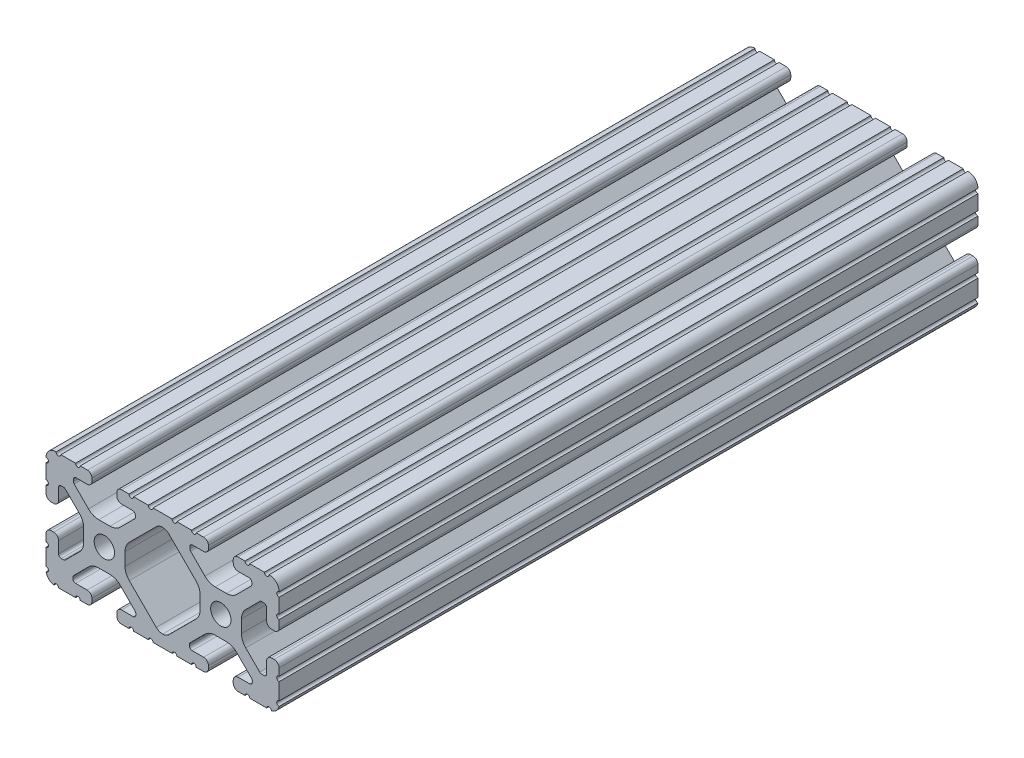
from build123d import *

# Parameters (mm, degrees)
SKETCH1_R      = 3.3274
EXTRUDE1_DEPTH = 228.6


with BuildPart() as part:
    # Sketch1 → Extrude1 (new body)
    with BuildSketch(Plane.XY):
        with BuildLine():
            Line((-3.121121376, -19.05), (3.121121376, -19.05))
            ThreePointArc((3.121121376, -19.05), (3.883121376, -18.288), (4.645121376, -19.05))
            Line((4.645121376, -19.05), (8.633115796, -19.05))
            Line((8.633115796, -19.05), (9.473536067, -19.05))
            ThreePointArc((9.473536067, -19.05), (10.235536067, -18.288), (10.997536067, -19.05))
            Line((10.997536067, -19.05), (13.4112, -19.05))
            ThreePointArc((13.4112, -19.05), (14.524751759, -18.588751759), (14.986, -17.4752))
            Line((14.986, -17.4752), (14.986, -16.5608))
            ThreePointArc((14.986, -16.5608), (14.524751759, -15.447248241), (13.4112, -14.986))
            Line((13.4112, -14.986), (9.652, -14.986))
            ThreePointArc((9.652, -14.986), (9.023382072, -14.725617928), (8.763, -14.097))
            Line((8.763, -14.097), (8.763, -13.687179678))
            ThreePointArc((8.763, -13.687179678), (8.830670671, -13.346975131), (9.023380503, -13.058563318))
            Line((9.023380503, -13.058563318), (13.852498595, -8.229421131))
            ThreePointArc((13.852498595, -8.229421131), (15.393447522, -7.199787805), (17.211122763, -6.838228541))
            Line((17.211122763, -6.838228541), (20.888877237, -6.838228541))
            ThreePointArc((20.888877237, -6.838228541), (22.706552478, -7.199787805), (24.247501405, -8.229421131))
            Line((24.247501405, -8.229421131), (29.076619497, -13.058563318))
            ThreePointArc((29.076619497, -13.058563318), (29.269329329, -13.346975131), (29.337, -13.687179678))
            Line((29.337, -13.687179678), (29.337, -14.097))
            ThreePointArc((29.337, -14.097), (29.076617928, -14.725617928), (28.448, -14.986))
            Line((28.448, -14.986), (24.6888, -14.986))
            ThreePointArc((24.6888, -14.986), (23.575248241, -15.447248241), (23.114, -16.5608))
            Line((23.114, -16.5608), (23.114, -17.4752))
            ThreePointArc((23.114, -17.4752), (23.575248241, -18.588751759), (24.6888, -19.05))
            Line((24.6888, -19.05), (26.945817469, -19.05))
            ThreePointArc((26.945817469, -19.05), (27.707817469, -18.288), (28.469817469, -19.05))
            Line((28.469817469, -19.05), (29.207115796, -19.05))
            Line((29.207115796, -19.05), (34.047273398, -19.05))
            ThreePointArc((34.047273398, -19.05), (34.809273398, -18.288), (35.571273398, -19.05))
            ThreePointArc((35.571273398, -19.05), (37.207577603, -18.182738167), (38.1, -16.560019212))
            ThreePointArc((38.1, -16.560019212), (37.338, -15.798019212), (38.1, -15.036019212))
            Line((38.1, -15.036019212), (38.1, -10.287))
            Line((38.1, -10.287), (38.1, -9.549701672))
            ThreePointArc((38.1, -9.549701672), (37.338, -8.787701672), (38.1, -8.025701672))
            Line((38.1, -8.025701672), (38.1, -5.6388))
            ThreePointArc((38.1, -5.6388), (37.638751759, -4.525248241), (36.5252, -4.064))
            Line((36.5252, -4.064), (35.6108, -4.064))
            ThreePointArc((35.6108, -4.064), (34.497248241, -4.525248241), (34.036, -5.6388))
            Line((34.036, -5.6388), (34.036, -9.398))
            ThreePointArc((34.036, -9.398), (33.775617928, -10.026617928), (33.147, -10.287))
            Line((33.147, -10.287), (32.420656743, -10.287))
            ThreePointArc((32.420656743, -10.287), (32.080450147, -10.21932848), (31.792037247, -10.02661636))
            Line((31.792037247, -10.02661636), (27.197575832, -5.43213202))
            ThreePointArc((27.197575832, -5.43213202), (26.167954729, -3.891188903), (25.8064, -2.07352461))
            Line((25.8064, -2.07352461), (25.8064, 2.07352461))
            ThreePointArc((25.8064, 2.07352461), (26.167954729, 3.891188903), (27.197575832, 5.43213202))
            Line((27.197575832, 5.43213202), (31.792037247, 10.02661636))
            ThreePointArc((31.792037247, 10.02661636), (32.080450147, 10.21932848), (32.420656743, 10.287))
            Line((32.420656743, 10.287), (33.147, 10.287))
            ThreePointArc((33.147, 10.287), (33.775617928, 10.026617928), (34.036, 9.398))
            Line((34.036, 9.398), (34.036, 5.6388))
            ThreePointArc((34.036, 5.6388), (34.497248241, 4.525248241), (35.6108, 4.064))
            Line((35.6108, 4.064), (36.5252, 4.064))
            ThreePointArc((36.5252, 4.064), (37.638751759, 4.525248241), (38.1, 5.6388))
            Line((38.1, 5.6388), (38.1, 8.025701672))
            ThreePointArc((38.1, 8.025701672), (37.338, 8.787701672), (38.1, 9.549701672))
            Line((38.1, 9.549701672), (38.1, 10.287))
            Line((38.1, 10.287), (38.1, 14.375206214))
            ThreePointArc((38.1, 14.375206214), (37.338232276, 15.156019383), (38.137614868, 15.89827725))
            ThreePointArc((38.137614868, 15.89827725), (37.148019028, 18.192014021), (34.819536496, 19.096833012))
            ThreePointArc((34.819536496, 19.096833012), (34.081312886, 18.311776389), (33.296256263, 19.05))
            Line((33.296256263, 19.05), (29.207115796, 19.05))
            Line((29.207115796, 19.05), (28.469817468, 19.05))
            ThreePointArc((28.469817468, 19.05), (27.707817468, 18.288), (26.945817468, 19.05))
            Line((26.945817468, 19.05), (24.558915796, 19.05))
            ThreePointArc((24.558915796, 19.05), (23.53023695, 18.547208069), (23.114, 17.480565346))
            Line((23.114, 17.480565346), (23.114, 16.5608))
            ThreePointArc((23.114, 16.5608), (23.575248241, 15.447248241), (24.6888, 14.986))
            Line((24.6888, 14.986), (28.295243665, 14.986))
            ThreePointArc((28.295243665, 14.986), (28.923861593, 14.725617928), (29.184243665, 14.097))
            Line((29.184243665, 14.097), (29.184243665, 13.53442258))
            ThreePointArc((29.184243665, 13.53442258), (29.116572993, 13.194218033), (28.923863161, 12.90580622))
            Line((28.923863161, 12.90580622), (24.247501405, 8.229421131))
            ThreePointArc((24.247501405, 8.229421131), (22.706552478, 7.199787805), (20.888877237, 6.838228541))
            Line((20.888877237, 6.838228541), (17.211122763, 6.838228541))
            ThreePointArc((17.211122763, 6.838228541), (15.393447522, 7.199787805), (13.852498595, 8.229421131))
            Line((13.852498595, 8.229421131), (9.176136839, 12.90580622))
            ThreePointArc((9.176136839, 12.90580622), (8.983427007, 13.194218033), (8.915756335, 13.53442258))
            Line((8.915756335, 13.53442258), (8.915756335, 14.097))
            ThreePointArc((8.915756335, 14.097), (9.176138407, 14.725617928), (9.804756335, 14.986))
            Line((9.804756335, 14.986), (13.4112, 14.986))
            ThreePointArc((13.4112, 14.986), (14.524751759, 15.447248241), (14.986, 16.5608))
            Line((14.986, 16.5608), (14.986, 17.496772581))
            ThreePointArc((14.986, 17.496772581), (14.531070222, 18.595070222), (13.432772581, 19.05))
            Line((13.432772581, 19.05), (10.997536067, 19.05))
            ThreePointArc((10.997536067, 19.05), (10.235536067, 18.288), (9.473536067, 19.05))
            Line((9.473536067, 19.05), (8.633115796, 19.05))
            Line((8.633115796, 19.05), (4.645121376, 19.05))
            ThreePointArc((4.645121376, 19.05), (3.883121376, 18.288), (3.121121376, 19.05))
            Line((3.121121376, 19.05), (-3.121121376, 19.05))
            ThreePointArc((-3.121121376, 19.05), (-3.883121376, 18.288), (-4.645121376, 19.05))
            Line((-4.645121376, 19.05), (-8.633115796, 19.05))
            Line((-8.633115796, 19.05), (-9.473536067, 19.05))
            ThreePointArc((-9.473536067, 19.05), (-10.235536067, 18.288), (-10.997536067, 19.05))
            Line((-10.997536067, 19.05), (-13.432772581, 19.05))
            ThreePointArc((-13.432772581, 19.05), (-14.531070222, 18.595070222), (-14.986, 17.496772581))
            Line((-14.986, 17.496772581), (-14.986, 16.5608))
            ThreePointArc((-14.986, 16.5608), (-14.524751759, 15.447248241), (-13.4112, 14.986))
            Line((-13.4112, 14.986), (-9.804756335, 14.986))
            ThreePointArc((-9.804756335, 14.986), (-9.176138407, 14.725617928), (-8.915756335, 14.097))
            Line((-8.915756335, 14.097), (-8.915756335, 13.53442258))
            ThreePointArc((-8.915756335, 13.53442258), (-8.983427007, 13.194218033), (-9.176136839, 12.90580622))
            Line((-9.176136839, 12.90580622), (-13.852498595, 8.229421131))
            ThreePointArc((-13.852498595, 8.229421131), (-15.393447522, 7.199787805), (-17.211122763, 6.838228541))
            Line((-17.211122763, 6.838228541), (-20.888877237, 6.838228541))
            ThreePointArc((-20.888877237, 6.838228541), (-22.706552478, 7.199787805), (-24.247501405, 8.229421131))
            Line((-24.247501405, 8.229421131), (-28.923863161, 12.90580622))
            ThreePointArc((-28.923863161, 12.90580622), (-29.116572993, 13.194218033), (-29.184243665, 13.53442258))
            Line((-29.184243665, 13.53442258), (-29.184243665, 14.097))
            ThreePointArc((-29.184243665, 14.097), (-28.923861593, 14.725617928), (-28.295243665, 14.986))
            Line((-28.295243665, 14.986), (-24.6888, 14.986))
            ThreePointArc((-24.6888, 14.986), (-23.575248241, 15.447248241), (-23.114, 16.5608))
            Line((-23.114, 16.5608), (-23.114, 17.480565346))
            ThreePointArc((-23.114, 17.480565346), (-23.53023695, 18.547208069), (-24.558915796, 19.05))
            Line((-24.558915796, 19.05), (-26.945817468, 19.05))
            ThreePointArc((-26.945817468, 19.05), (-27.707817468, 18.288), (-28.469817468, 19.05))
            Line((-28.469817468, 19.05), (-29.207115796, 19.05))
            Line((-29.207115796, 19.05), (-33.296256263, 19.05))
            ThreePointArc((-33.296256263, 19.05), (-34.081312886, 18.311776389), (-34.819536496, 19.096833012))
            ThreePointArc((-34.819536496, 19.096833012), (-37.148019028, 18.192014021), (-38.137614868, 15.89827725))
            ThreePointArc((-38.137614868, 15.89827725), (-37.338232276, 15.156019383), (-38.1, 14.375206214))
            Line((-38.1, 14.375206214), (-38.1, 10.287))
            Line((-38.1, 10.287), (-38.1, 9.549701672))
            ThreePointArc((-38.1, 9.549701672), (-37.338, 8.787701672), (-38.1, 8.025701672))
            Line((-38.1, 8.025701672), (-38.1, 5.6388))
            ThreePointArc((-38.1, 5.6388), (-37.638751759, 4.525248241), (-36.5252, 4.064))
            Line((-36.5252, 4.064), (-35.6108, 4.064))
            ThreePointArc((-35.6108, 4.064), (-34.497248241, 4.525248241), (-34.036, 5.6388))
            Line((-34.036, 5.6388), (-34.036, 9.398))
            ThreePointArc((-34.036, 9.398), (-33.775617928, 10.026617928), (-33.147, 10.287))
            Line((-33.147, 10.287), (-32.420656743, 10.287))
            ThreePointArc((-32.420656743, 10.287), (-32.080450147, 10.21932848), (-31.792037247, 10.02661636))
            Line((-31.792037247, 10.02661636), (-27.197575832, 5.43213202))
            ThreePointArc((-27.197575832, 5.43213202), (-26.167954729, 3.891188903), (-25.8064, 2.07352461))
            Line((-25.8064, 2.07352461), (-25.8064, -2.07352461))
            ThreePointArc((-25.8064, -2.07352461), (-26.167954729, -3.891188903), (-27.197575832, -5.43213202))
            Line((-27.197575832, -5.43213202), (-31.792037247, -10.02661636))
            ThreePointArc((-31.792037247, -10.02661636), (-32.080450147, -10.21932848), (-32.420656743, -10.287))
            Line((-32.420656743, -10.287), (-33.147, -10.287))
            ThreePointArc((-33.147, -10.287), (-33.775617928, -10.026617928), (-34.036, -9.398))
            Line((-34.036, -9.398), (-34.036, -5.6388))
            ThreePointArc((-34.036, -5.6388), (-34.497248241, -4.525248241), (-35.6108, -4.064))
            Line((-35.6108, -4.064), (-36.5252, -4.064))
            ThreePointArc((-36.5252, -4.064), (-37.638751759, -4.525248241), (-38.1, -5.6388))
            Line((-38.1, -5.6388), (-38.1, -8.025701672))
            ThreePointArc((-38.1, -8.025701672), (-37.338, -8.787701672), (-38.1, -9.549701672))
            Line((-38.1, -9.549701672), (-38.1, -10.287))
            Line((-38.1, -10.287), (-38.1, -15.036019212))
            ThreePointArc((-38.1, -15.036019212), (-37.338, -15.798019212), (-38.1, -16.560019212))
            ThreePointArc((-38.1, -16.560019212), (-37.20882252, -18.184002456), (-35.571273398, -19.05))
            ThreePointArc((-35.571273398, -19.05), (-34.809273398, -18.288), (-34.047273398, -19.05))
            Line((-34.047273398, -19.05), (-29.207115796, -19.05))
            Line((-29.207115796, -19.05), (-28.469817469, -19.05))
            ThreePointArc((-28.469817469, -19.05), (-27.707817469, -18.288), (-26.945817469, -19.05))
            Line((-26.945817469, -19.05), (-24.6888, -19.05))
            ThreePointArc((-24.6888, -19.05), (-23.575248241, -18.588751759), (-23.114, -17.4752))
            Line((-23.114, -17.4752), (-23.114, -16.5608))
            ThreePointArc((-23.114, -16.5608), (-23.575248241, -15.447248241), (-24.6888, -14.986))
            Line((-24.6888, -14.986), (-28.448, -14.986))
            ThreePointArc((-28.448, -14.986), (-29.076617928, -14.725617928), (-29.337, -14.097))
            Line((-29.337, -14.097), (-29.337, -13.687179678))
            ThreePointArc((-29.337, -13.687179678), (-29.269329329, -13.346975131), (-29.076619497, -13.058563318))
            Line((-29.076619497, -13.058563318), (-24.247501405, -8.229421131))
            ThreePointArc((-24.247501405, -8.229421131), (-22.706552478, -7.199787805), (-20.888877237, -6.838228541))
            Line((-20.888877237, -6.838228541), (-17.211122763, -6.838228541))
            ThreePointArc((-17.211122763, -6.838228541), (-15.393447522, -7.199787805), (-13.852498595, -8.229421131))
            Line((-13.852498595, -8.229421131), (-9.023380503, -13.058563318))
            ThreePointArc((-9.023380503, -13.058563318), (-8.830670671, -13.346975131), (-8.763, -13.687179678))
            Line((-8.763, -13.687179678), (-8.763, -14.097))
            ThreePointArc((-8.763, -14.097), (-9.023382072, -14.725617928), (-9.652, -14.986))
            Line((-9.652, -14.986), (-13.4112, -14.986))
            ThreePointArc((-13.4112, -14.986), (-14.524751759, -15.447248241), (-14.986, -16.5608))
            Line((-14.986, -16.5608), (-14.986, -17.4752))
            ThreePointArc((-14.986, -17.4752), (-14.524751759, -18.588751759), (-13.4112, -19.05))
            Line((-13.4112, -19.05), (-10.997536067, -19.05))
            ThreePointArc((-10.997536067, -19.05), (-10.235536067, -18.288), (-9.473536067, -19.05))
            Line((-9.473536067, -19.05), (-8.633115796, -19.05))
            Line((-8.633115796, -19.05), (-4.645121376, -19.05))
            ThreePointArc((-4.645121376, -19.05), (-3.883121376, -18.288), (-3.121121376, -19.05))
        make_face()
        with Locations((19.05, 0)):
            Circle(SKETCH1_R, mode=Mode.SUBTRACT)
        with Locations(Location((-19.05, 0, 0), (0, 0, 180))):
            Circle(SKETCH1_R, mode=Mode.SUBTRACT)
        with BuildLine():
            Line((2.077035361, 14.257564863), (10.902424168, 5.43213202))
            ThreePointArc((10.902424168, 5.43213202), (11.932045271, 3.891188903), (12.2936, 2.07352461))
            Line((12.2936, 2.07352461), (12.2936, -2.07352461))
            ThreePointArc((12.2936, -2.07352461), (11.932045271, -3.891188903), (10.902424168, -5.43213202))
            Line((10.902424168, -5.43213202), (2.077035361, -14.257564863))
            ThreePointArc((2.077035361, -14.257564863), (1.124045601, -14.892973012), (0, -15.113096807))
            ThreePointArc((0, -15.113096807), (-1.124045601, -14.892973012), (-2.077035361, -14.257564863))
            Line((-2.077035361, -14.257564863), (-10.902424168, -5.43213202))
            ThreePointArc((-10.902424168, -5.43213202), (-11.932045271, -3.891188903), (-12.2936, -2.07352461))
            Line((-12.2936, -2.07352461), (-12.2936, 2.07352461))
            ThreePointArc((-12.2936, 2.07352461), (-11.932045271, 3.891188903), (-10.902424168, 5.43213202))
            Line((-10.902424168, 5.43213202), (-2.077035361, 14.257564863))
            ThreePointArc((-2.077035361, 14.257564863), (-1.124045601, 14.892973012), (0, 15.113096807))
            ThreePointArc((0, 15.113096807), (1.124045601, 14.892973012), (2.077035361, 14.257564863))
        make_face(mode=Mode.SUBTRACT)
    extrude(amount=-EXTRUDE1_DEPTH)


solid = part.part
